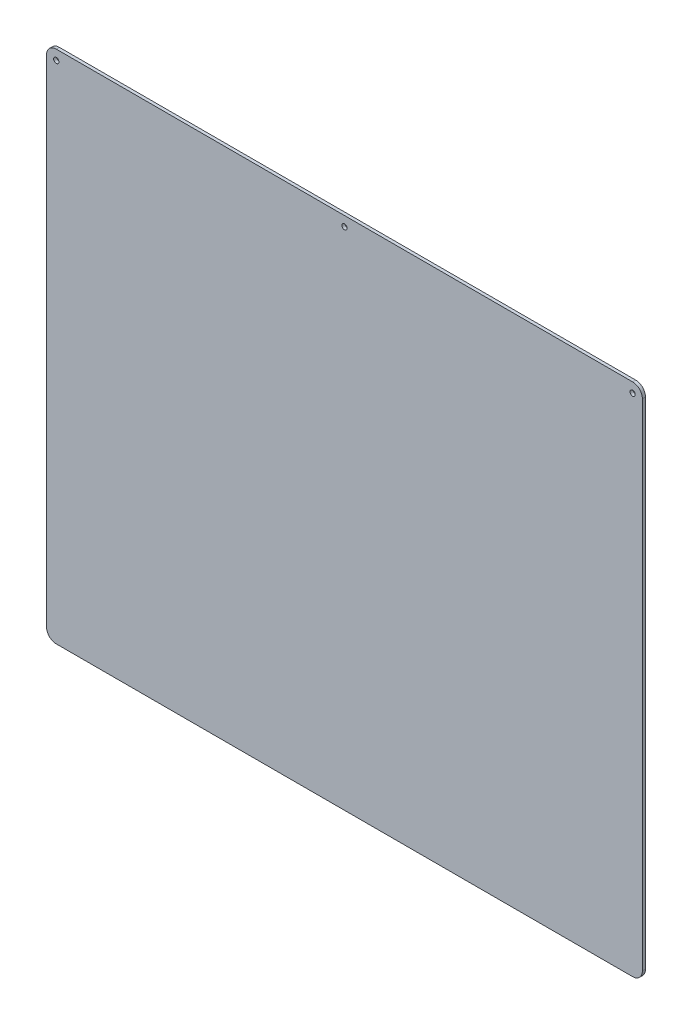
from build123d import *

# Parameters (mm, degrees)
SKETCH1_W           = 609.6
SKETCH1_H           = 526.976
BOSS_EXTRUDE1_DEPTH = 3.175
FILLET1_R           = 10
SKETCH2_R           = 2.7
CUT_EXTRUDE1_DEPTH  = 3.175


with BuildPart() as part:
    # Sketch1 → Boss-Extrude1 (new body)
    with BuildSketch(Plane.XY):
        with Locations((-76.698046875, -126.020421875)):
            Rectangle(SKETCH1_W, SKETCH1_H)
    extrude(amount=BOSS_EXTRUDE1_DEPTH)

    # Fillet1
    fillet1_edges = [part.edges().sort_by_distance(p)[0] for p in [
        (-381.498046875, 137.467578125, 1.5875),
        (228.101953125, 137.467578125, 1.5875),
        (228.101953125, -389.508421875, 1.5875),
        (-381.498046875, -389.508421875, 1.5875),
    ]]
    fillet(fillet1_edges, radius=FILLET1_R)

    # Sketch2 → Cut-Extrude1 (cut)
    with BuildSketch(Plane.XY.offset(3.175)):
        with Locations((-371.498046875, 127.467578125)):
            Circle(SKETCH2_R)
        with Locations((218.101953125, 127.467578125)):
            Circle(SKETCH2_R)
        with Locations((-76.698046875, 127.467578125)):
            Circle(SKETCH2_R)
        with BuildLine():
            Line((-1247.34049085, -361.808421875), (-1241.34049085, -361.808421875))
            ThreePointArc((-1241.34049085, -361.808421875), (-1239.926277288, -362.394208313), (-1239.34049085, -363.808421875))
            Line((-1239.34049085, -363.808421875), (-1239.34049085, -365.208421875))
            ThreePointArc((-1239.34049085, -365.208421875), (-1239.926277288, -366.622635437), (-1241.34049085, -367.208421875))
            Line((-1241.34049085, -367.208421875), (-1247.34049085, -367.208421875))
            ThreePointArc((-1247.34049085, -367.208421875), (-1248.754704413, -366.622635437), (-1249.34049085, -365.208421875))
            Line((-1249.34049085, -365.208421875), (-1249.34049085, -363.808421875))
            ThreePointArc((-1249.34049085, -363.808421875), (-1248.754704413, -362.394208313), (-1247.34049085, -361.808421875))
        make_face()
        with BuildLine():
            Line((-651.74049085, -367.208421875), (-657.74049085, -367.208421875))
            ThreePointArc((-657.74049085, -367.208421875), (-659.154704413, -366.622635437), (-659.74049085, -365.208421875))
            Line((-659.74049085, -365.208421875), (-659.74049085, -363.808421875))
            ThreePointArc((-659.74049085, -363.808421875), (-659.154704413, -362.394208313), (-657.74049085, -361.808421875))
            Line((-657.74049085, -361.808421875), (-651.74049085, -361.808421875))
            ThreePointArc((-651.74049085, -361.808421875), (-650.326277288, -362.394208313), (-649.74049085, -363.808421875))
            Line((-649.74049085, -363.808421875), (-649.74049085, -365.208421875))
            ThreePointArc((-649.74049085, -365.208421875), (-650.326277288, -366.622635437), (-651.74049085, -367.208421875))
        make_face()
    extrude(amount=-CUT_EXTRUDE1_DEPTH, mode=Mode.SUBTRACT)


solid = part.part
